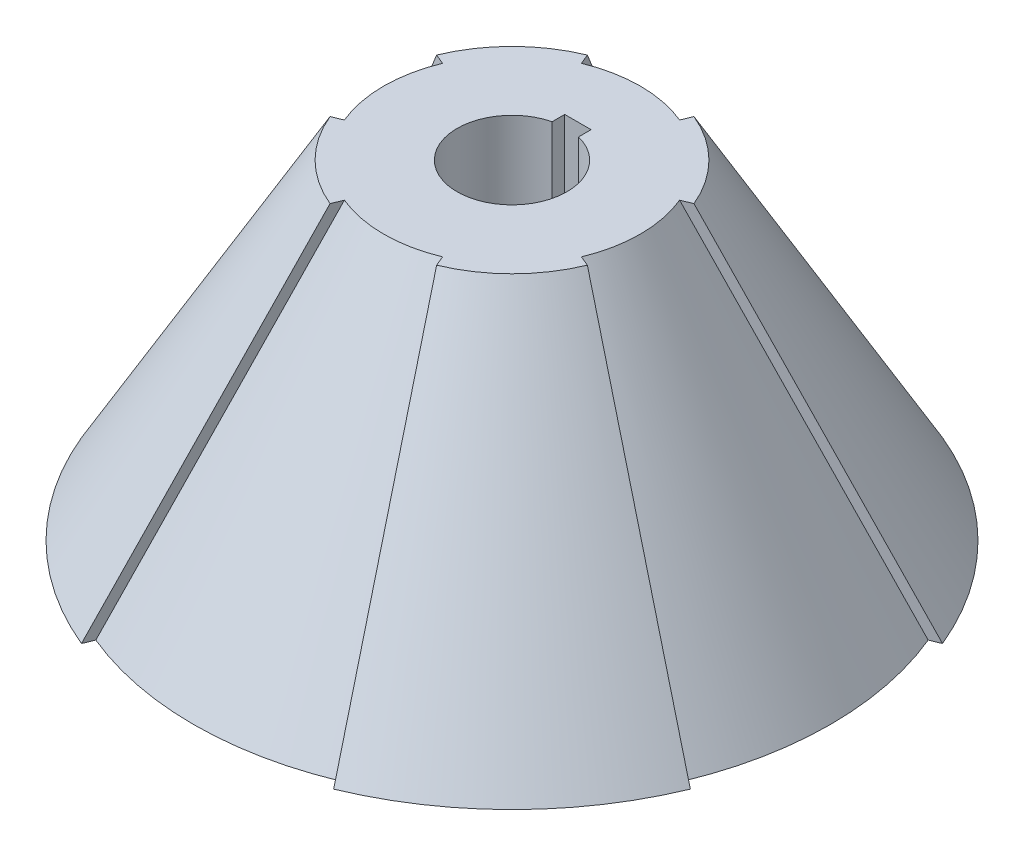
from build123d import *

# Parameters (mm, degrees)
CUT_EXTRUDE1_DEPTH      = 66.991135768
CUT_EXTRUDE1_DEPTH_BACK = 66.991135768
CUT_REVOLVE1_ANGLE      = 45
CIRPATTERN1_COUNT       = 4


with BuildPart() as part:
    # Sketch1 → Revolve1 (revolve)
    with BuildSketch(Plane.XY, mode=Mode.PRIVATE) as revolve1_sk:
        Polygon((6.35, 0), (6.35, 38.1), (16.102954744, 38.1), (38.1, 0), align=None)
    revolve(revolve1_sk.sketch.rotate(Axis((0, 0, 0), (0, 1, 0)), 90), axis=Axis((0, 0, 0), (0, 1, 0)))

    # Sketch2 → Cut-Extrude1 (cut, two sides: drawn at the far end of the back side and taken through both)
    with BuildSketch(Plane(origin=(0, 38.1, 0), x_dir=(1, 0, 0), z_dir=(0, 1, 0)).offset(-CUT_EXTRUDE1_DEPTH_BACK)):
        with BuildLine():
            Line((1.524, 7.62), (-1.524, 7.62))
            Line((-1.524, 7.62), (-1.524, 6.164407839))
            ThreePointArc((-1.524, 6.164407839), (0, 6.35), (1.524, 6.164407839))
            Line((1.524, 6.164407839), (1.524, 7.62))
        make_face()
    extrude(amount=CUT_EXTRUDE1_DEPTH + CUT_EXTRUDE1_DEPTH_BACK, mode=Mode.SUBTRACT)

    # Sketch3 → Cut-Revolve1 (revolve, symmetric, cut)
    with BuildSketch(Plane(origin=(0, 0, 0), x_dir=(0, 0, -1), z_dir=(1, 0, 0))) as cut_revolve1_sk:
        Polygon((16.102954744, 38.1), (14.832954744, 38.1), (36.83, 0), (38.1, 0), align=None)
    cut_revolve1 = revolve(axis=Axis((0, 0, 0), (0, 1, 0)), revolution_arc=CUT_REVOLVE1_ANGLE / 2, mode=Mode.SUBTRACT)
    cut_revolve1 = cut_revolve1 + revolve(cut_revolve1_sk.sketch, axis=Axis((0, 0, 0), (0, -1, 0)), revolution_arc=CUT_REVOLVE1_ANGLE / 2, mode=Mode.SUBTRACT)

    # CirPattern1: Cut-Revolve1 ×4 about axis
    cirpattern1_axis = Axis((0, 38.1, 0), (0, -1, 0))
    for i in range(1, CIRPATTERN1_COUNT):
        add(cut_revolve1.rotate(cirpattern1_axis, i * 360 / CIRPATTERN1_COUNT), mode=Mode.SUBTRACT)


solid = part.part
